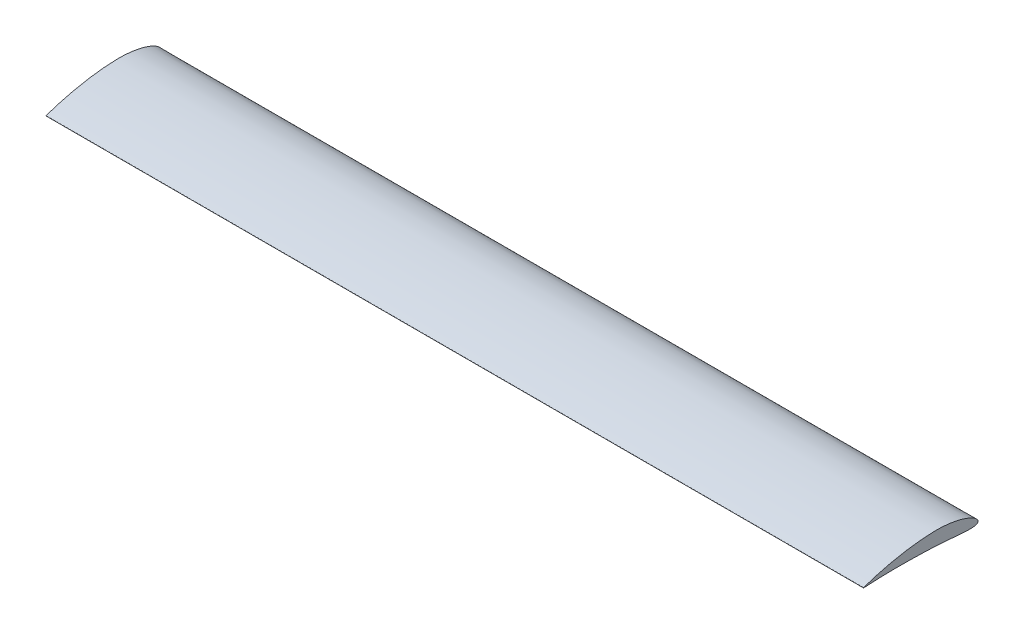
from build123d import *

# Parameters (mm, degrees)
BOSS_EXTRUDE1_DEPTH      = 1270
BOSS_EXTRUDE1_DEPTH_BACK = 1270


with BuildPart() as part:
    # Sketch1 → Boss-Extrude1 (new, two sides: drawn at the far end of the back side and taken through both)
    with BuildSketch(Plane(origin=(0, 0, 0), x_dir=(0, 0, -1), z_dir=(1, 0, 0)).offset(-BOSS_EXTRUDE1_DEPTH_BACK)):
        with BuildLine():
            Line((-354.787327228, -0.030257196), (-354.876173011, 0.410417887))
            add(Edge.make_bspline(
                [(-354.876173011, 0.410417887), (-354.559877309, 0.519388), (-353.29965963, 0.95355787), (-350.47872665, 1.927095868), (-345.800950265, 3.497798274), (-336.024074692, 6.721551148), (-319.654473712, 11.798891927), (-300.598349456, 17.130600639), (-282.422876264, 21.724272526), (-261.175777938, 26.651569731), (-238.622276389, 31.145528798), (-208.774809213, 36.004755717), (-183.96165787, 39.090454058), (-158.902335219, 41.113212891), (-140.096691022, 42.111376668), (-121.516747473, 42.228858195), (-103.422167262, 41.321050632), (-86.188408528, 39.478676181), (-70.043450957, 36.810480574), (-55.199760436, 33.432905997), (-41.843390777, 29.510854383), (-30.130463623, 25.220125297), (-20.187014188, 20.73431935), (-12.107203154, 16.226289935), (-5.926897661, 11.855341958), (-1.679224073, 7.716499794), (0.765838065, 3.796757813), (0.987487677, -0.148325216), (-1.35108726, -3.308943186), (-5.450780885, -5.288085739), (-11.087315968, -6.587464624), (-18.34911979, -7.268527656), (-27.163826626, -7.404874951), (-37.447057223, -7.053797092), (-49.083078017, -6.301866785), (-61.95239395, -5.238034817), (-75.929862643, -3.983911698), (-96.406736552, -2.153555858), (-117.937239158, -0.458414508), (-140.484776897, 0.674535203), (-158.296467959, 1.286744043), (-176.48388462, 1.917893193), (-200.671973719, 2.586246563), (-224.541124114, 2.979106232), (-247.830237405, 3.028480659), (-264.337268621, 2.907447598), (-279.933149694, 2.656365926), (-294.437996632, 2.282890374), (-307.681856469, 1.852126627), (-319.513378006, 1.371074809), (-329.767358246, 0.912902227), (-338.388880463, 0.426846955), (-345.076973543, 0.191518705), (-350.227621538, -0.406394891), (-352.780150329, -0.035387827), (-354.744619464, -0.75811662), (-354.777220059, -0.20251155), (-354.787327228, -0.030257196)],
                knots=[0, 0, 0, 0, 0.001371577, 0.005464776, 0.012234802, 0.021601969, 0.04767125, 0.082496261, 0.102719149, 0.124527079, 0.171912573, 0.19697838, 0.248496767, 0.274385101, 0.300041178, 0.325689988, 0.350525088, 0.374279703, 0.396711254, 0.417576734, 0.436654006, 0.45374439, 0.468679994, 0.481329415, 0.491630702, 0.499615789, 0.505546281, 0.510184984, 0.514824194, 0.520701508, 0.52851604, 0.538465752, 0.550542609, 0.564643256, 0.580638139, 0.598344876, 0.617584458, 0.638174401, 0.682632113, 0.706120665, 0.730727383, 0.755700244, 0.780731769, 0.829932396, 0.853570292, 0.876213105, 0.897609987, 0.917519394, 0.935698347, 0.951942678, 0.966047159, 0.97783994, 0.987174002, 0.993931501, 0.998018399, 0.999385644, 1, 1, 1, 1], degree=3))
        make_face()
    extrude(amount=BOSS_EXTRUDE1_DEPTH + BOSS_EXTRUDE1_DEPTH_BACK)


solid = part.part
